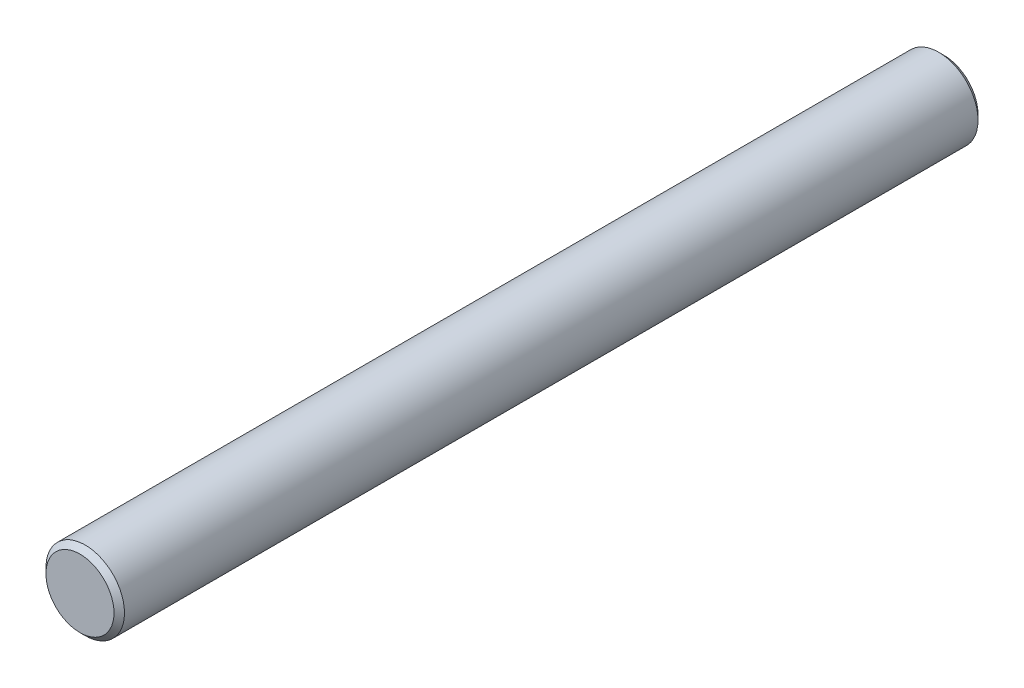
from build123d import *

# Parameters (mm, degrees)
SKETCH1_R           = 1.5
BOSS_EXTRUDE1_DEPTH = 33
CHAMFER1_SIZE       = 0.2


with BuildPart() as part:
    # Sketch1 → Boss-Extrude1 (new body)
    with BuildSketch(Plane.XY):
        Circle(SKETCH1_R)
    extrude(amount=BOSS_EXTRUDE1_DEPTH)

    # Chamfer1
    chamfer1_edges = [part.edges().sort_by_distance(p)[0] for p in [
        (-1.5, 0, 0),
        (-1.5, 0, 33),
    ]]
    chamfer(chamfer1_edges, length=CHAMFER1_SIZE)


solid = part.part
